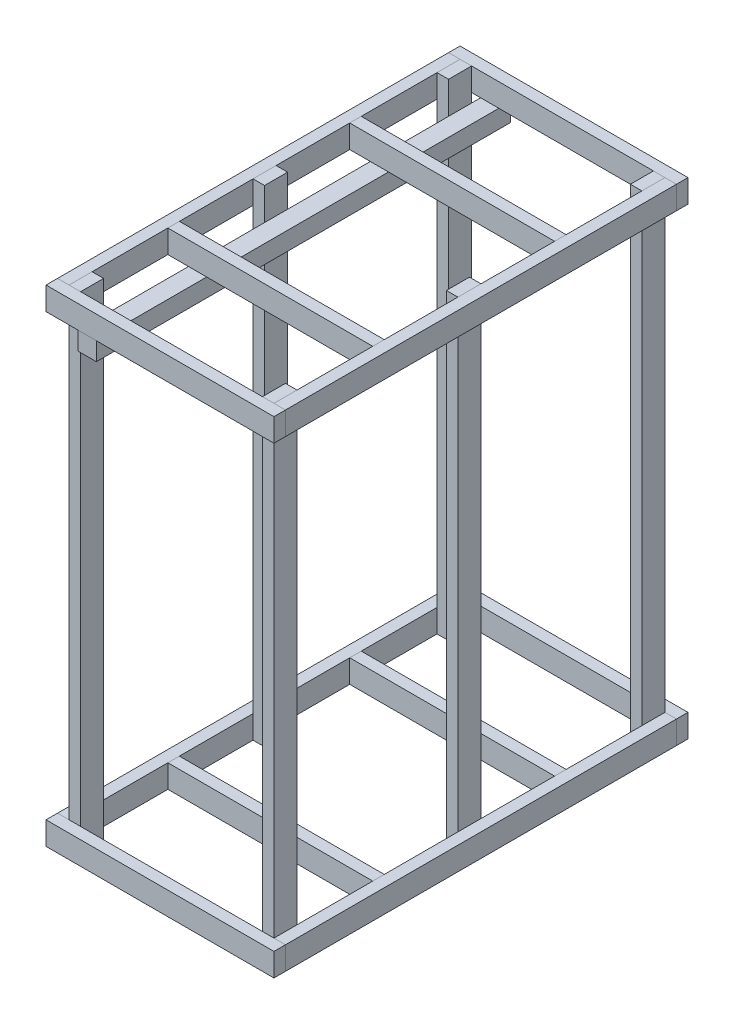
from build123d import *

# Parameters (mm, degrees)
EXTRUDE_1_DEPTH        = 322.5
EXTRUDE_1_DEPTH_BACK   = 322.5
SKETCH_6_W             = 19
SKETCH_6_H             = 38
EXTRUDE_1_2_DEPTH      = 322.5
EXTRUDE_1_2_DEPTH_BACK = 322.5
EXTRUDE_1_3_DEPTH      = 322.5
EXTRUDE_1_3_DEPTH_BACK = 322.5
EXTRUDE_1_4_DEPTH      = 322.5
EXTRUDE_1_4_DEPTH_BACK = 322.5
EXTRUDE_2_DEPTH        = 188
EXTRUDE_2_DEPTH_BACK   = 188
SKETCH_8_W             = 19
SKETCH_8_H             = 38
EXTRUDE_2_2_DEPTH      = 188
EXTRUDE_2_2_DEPTH_BACK = 188
EXTRUDE_2_3_DEPTH      = 188
EXTRUDE_2_3_DEPTH_BACK = 188
EXTRUDE_2_4_DEPTH      = 188
EXTRUDE_2_4_DEPTH_BACK = 188
EXTRUDE_START          = -58
SKETCH_9_W             = 19
SKETCH_9_H             = 38
EXTRUDE_2009_DEPTH     = 802
EXTRUDE_2009_2_DEPTH   = 802
EXTRUDE_2009_3_DEPTH   = 802
EXTRUDE_2009_4_DEPTH   = 802
EXTRUDE_2009_5_DEPTH   = 802
EXTRUDE_2009_6_DEPTH   = 802
EXTRUDE_START_2        = -341.5
SKETCH_10_W            = 30
SKETCH_10_H            = 30
EXTRUDE_4_DEPTH        = 683
EXTRUDE_5_DEPTH        = 169
EXTRUDE_5_DEPTH_BACK   = 169
SKETCH_11_W            = 19
SKETCH_11_H            = 38
EXTRUDE_5_2_DEPTH      = 169
EXTRUDE_5_2_DEPTH_BACK = 169
EXTRUDE_5_3_DEPTH      = 169
EXTRUDE_5_3_DEPTH_BACK = 169
EXTRUDE_5_4_DEPTH      = 169
EXTRUDE_5_4_DEPTH_BACK = 169


with BuildPart() as part:
    # ｽｹｯﾁ6 → ﾎﾞｽ - 押し出し1 (new, two sides: drawn at the far end of the back side and taken through both)
    with BuildSketch(Plane.XY.offset(-EXTRUDE_1_DEPTH_BACK)):
        with Locations((-178.5, -39)):
            Rectangle(SKETCH_6_W, SKETCH_6_H)
    extrude(amount=EXTRUDE_1_DEPTH + EXTRUDE_1_DEPTH_BACK)


with BuildPart() as body_2:
    # ｽｹｯﾁ6 → Extrude 1 2 (new, two sides: drawn at the far end of the back side and taken through both)
    with BuildSketch(Plane.XY.offset(-EXTRUDE_1_2_DEPTH_BACK)):
        with Locations((178.5, -39)):
            Rectangle(SKETCH_6_W, SKETCH_6_H)
    extrude(amount=EXTRUDE_1_2_DEPTH + EXTRUDE_1_2_DEPTH_BACK)


with BuildPart() as body_3:
    # ｽｹｯﾁ6 → Extrude 1 3 (new, two sides: drawn at the far end of the back side and taken through both)
    with BuildSketch(Plane.XY.offset(-EXTRUDE_1_3_DEPTH_BACK)):
        with Locations((178.5, 725)):
            Rectangle(SKETCH_6_W, SKETCH_6_H)
    extrude(amount=EXTRUDE_1_3_DEPTH + EXTRUDE_1_3_DEPTH_BACK)


with BuildPart() as body_4:
    # ｽｹｯﾁ6 → Extrude 1 4 (new, two sides: drawn at the far end of the back side and taken through both)
    with BuildSketch(Plane.XY.offset(-EXTRUDE_1_4_DEPTH_BACK)):
        with Locations((-178.5, 725)):
            Rectangle(SKETCH_6_W, SKETCH_6_H)
    extrude(amount=EXTRUDE_1_4_DEPTH + EXTRUDE_1_4_DEPTH_BACK)


with BuildPart() as body_5:
    # ｽｹｯﾁ8 → ﾎﾞｽ - 押し出し2 (new, two sides: drawn at the far end of the back side and taken through both)
    with BuildSketch(Plane(origin=(0, 0, 0), x_dir=(0, 0, -1), z_dir=(1, 0, 0)).offset(-EXTRUDE_2_DEPTH_BACK)):
        with Locations((-332, -39)):
            Rectangle(SKETCH_8_W, SKETCH_8_H)
    extrude(amount=EXTRUDE_2_DEPTH + EXTRUDE_2_DEPTH_BACK)


with BuildPart() as body_6:
    # ｽｹｯﾁ8 → Extrude 2 2 (new, two sides: drawn at the far end of the back side and taken through both)
    with BuildSketch(Plane(origin=(0, 0, 0), x_dir=(0, 0, -1), z_dir=(1, 0, 0)).offset(-EXTRUDE_2_2_DEPTH_BACK)):
        with Locations((-332, 725)):
            Rectangle(SKETCH_8_W, SKETCH_8_H)
    extrude(amount=EXTRUDE_2_2_DEPTH + EXTRUDE_2_2_DEPTH_BACK)


with BuildPart() as body_7:
    # ｽｹｯﾁ8 → Extrude 2 3 (new, two sides: drawn at the far end of the back side and taken through both)
    with BuildSketch(Plane(origin=(0, 0, 0), x_dir=(0, 0, -1), z_dir=(1, 0, 0)).offset(-EXTRUDE_2_3_DEPTH_BACK)):
        with Locations((332, 725)):
            Rectangle(SKETCH_8_W, SKETCH_8_H)
    extrude(amount=EXTRUDE_2_3_DEPTH + EXTRUDE_2_3_DEPTH_BACK)


with BuildPart() as body_8:
    # ｽｹｯﾁ8 → Extrude 2 4 (new, two sides: drawn at the far end of the back side and taken through both)
    with BuildSketch(Plane(origin=(0, 0, 0), x_dir=(0, 0, -1), z_dir=(1, 0, 0)).offset(-EXTRUDE_2_4_DEPTH_BACK)):
        with Locations((332, -39)):
            Rectangle(SKETCH_8_W, SKETCH_8_H)
    extrude(amount=EXTRUDE_2_4_DEPTH + EXTRUDE_2_4_DEPTH_BACK)


with BuildPart() as body_9:
    # ｽｹｯﾁ9 → Extrude 2009 (new body)
    with BuildSketch(Plane(origin=(0, 0, 0), x_dir=(1, 0, 0), z_dir=(0, 1, 0)).offset(EXTRUDE_START)):
        with Locations((-159.5, 303.5)):
            Rectangle(SKETCH_9_W, SKETCH_9_H)
    extrude(amount=EXTRUDE_2009_DEPTH)


with BuildPart() as body_10:
    # ｽｹｯﾁ9 → Extrude 2009 2 (new body)
    with BuildSketch(Plane(origin=(0, 0, 0), x_dir=(1, 0, 0), z_dir=(0, 1, 0)).offset(EXTRUDE_START)):
        with Locations((-159.5, -303.5)):
            Rectangle(SKETCH_9_W, SKETCH_9_H)
    extrude(amount=EXTRUDE_2009_2_DEPTH)


with BuildPart() as body_11:
    # ｽｹｯﾁ9 → Extrude 2009 3 (new body)
    with BuildSketch(Plane(origin=(0, 0, 0), x_dir=(1, 0, 0), z_dir=(0, 1, 0)).offset(EXTRUDE_START)):
        with Locations((159.5, 303.5)):
            Rectangle(SKETCH_9_W, SKETCH_9_H)
    extrude(amount=EXTRUDE_2009_3_DEPTH)


with BuildPart() as body_12:
    # ｽｹｯﾁ9 → Extrude 2009 4 (new body)
    with BuildSketch(Plane(origin=(0, 0, 0), x_dir=(1, 0, 0), z_dir=(0, 1, 0)).offset(EXTRUDE_START)):
        with Locations((159.5, -303.5)):
            Rectangle(SKETCH_9_W, SKETCH_9_H)
    extrude(amount=EXTRUDE_2009_4_DEPTH)


with BuildPart() as body_13:
    # ｽｹｯﾁ9 → Extrude 2009 5 (new body)
    with BuildSketch(Plane(origin=(0, 0, 0), x_dir=(1, 0, 0), z_dir=(0, 1, 0)).offset(EXTRUDE_START)):
        with Locations((-159.5, 0)):
            Rectangle(SKETCH_9_W, SKETCH_9_H)
    extrude(amount=EXTRUDE_2009_5_DEPTH)


with BuildPart() as body_14:
    # ｽｹｯﾁ9 → Extrude 2009 6 (new body)
    with BuildSketch(Plane(origin=(0, 0, 0), x_dir=(1, 0, 0), z_dir=(0, 1, 0)).offset(EXTRUDE_START)):
        with Locations((159.5, 0)):
            Rectangle(SKETCH_9_W, SKETCH_9_H)
    extrude(amount=EXTRUDE_2009_6_DEPTH)


with BuildPart() as body_15:
    # ｽｹｯﾁ10 → ﾎﾞｽ - 押し出し4 (new body)
    with BuildSketch(Plane.XY.offset(EXTRUDE_START_2)):
        with Locations((-120, 691)):
            Rectangle(SKETCH_10_W, SKETCH_10_H)
    extrude(amount=EXTRUDE_4_DEPTH)


with BuildPart() as body_16:
    # ｽｹｯﾁ11 → ﾎﾞｽ - 押し出し5 (new, two sides: drawn at the far end of the back side and taken through both)
    with BuildSketch(Plane(origin=(0, 0, 0), x_dir=(0, 0, -1), z_dir=(1, 0, 0)).offset(-EXTRUDE_5_DEPTH_BACK)):
        with Locations((-150, 725)):
            Rectangle(SKETCH_11_W, SKETCH_11_H)
    extrude(amount=EXTRUDE_5_DEPTH + EXTRUDE_5_DEPTH_BACK)


with BuildPart() as body_17:
    # ｽｹｯﾁ11 → Extrude 5 2 (new, two sides: drawn at the far end of the back side and taken through both)
    with BuildSketch(Plane(origin=(0, 0, 0), x_dir=(0, 0, -1), z_dir=(1, 0, 0)).offset(-EXTRUDE_5_2_DEPTH_BACK)):
        with Locations((-150, -39)):
            Rectangle(SKETCH_11_W, SKETCH_11_H)
    extrude(amount=EXTRUDE_5_2_DEPTH + EXTRUDE_5_2_DEPTH_BACK)


with BuildPart() as body_18:
    # ｽｹｯﾁ11 → Extrude 5 3 (new, two sides: drawn at the far end of the back side and taken through both)
    with BuildSketch(Plane(origin=(0, 0, 0), x_dir=(0, 0, -1), z_dir=(1, 0, 0)).offset(-EXTRUDE_5_3_DEPTH_BACK)):
        with Locations((150, -39)):
            Rectangle(SKETCH_11_W, SKETCH_11_H)
    extrude(amount=EXTRUDE_5_3_DEPTH + EXTRUDE_5_3_DEPTH_BACK)


with BuildPart() as body_19:
    # ｽｹｯﾁ11 → Extrude 5 4 (new, two sides: drawn at the far end of the back side and taken through both)
    with BuildSketch(Plane(origin=(0, 0, 0), x_dir=(0, 0, -1), z_dir=(1, 0, 0)).offset(-EXTRUDE_5_4_DEPTH_BACK)):
        with Locations((150, 725)):
            Rectangle(SKETCH_11_W, SKETCH_11_H)
    extrude(amount=EXTRUDE_5_4_DEPTH + EXTRUDE_5_4_DEPTH_BACK)


solid = Compound([part.part, body_2.part, body_3.part, body_4.part, body_5.part, body_6.part, body_7.part, body_8.part, body_9.part, body_10.part, body_11.part, body_12.part, body_13.part, body_14.part, body_15.part, body_16.part, body_17.part, body_18.part, body_19.part])
